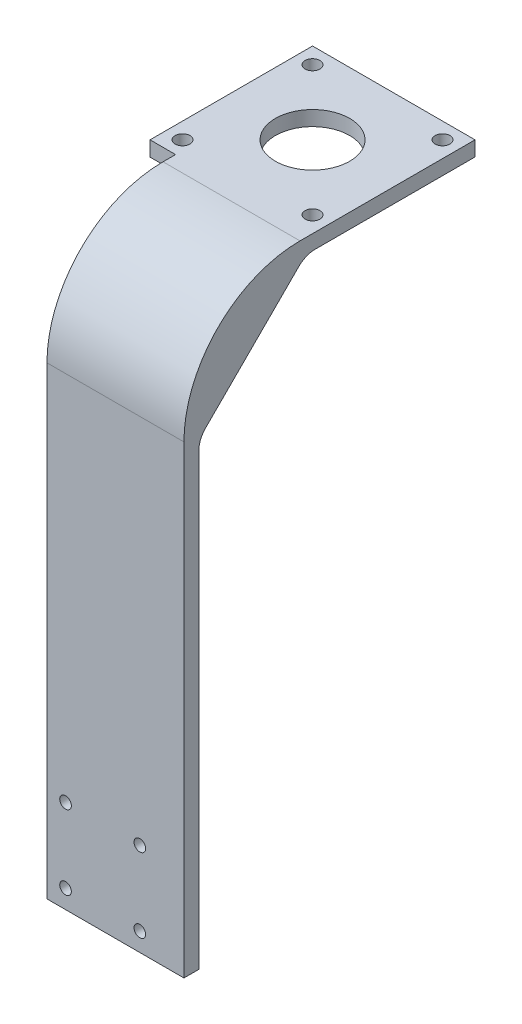
from build123d import *

# Parameters (mm, degrees)
SKETCH1_W           = 24
SKETCH1_H           = 125
SKETCH1_R           = 1.25
BOSS_EXTRUDE1_DEPTH = 3.2
SKETCH2_W           = 24
SKETCH2_H           = 3.2
BOSS_EXTRUDE2_DEPTH = 42
SKETCH3_W           = 35
SKETCH3_H           = 35
SKETCH3_R           = 1.6
BOSS_EXTRUDE3_DEPTH = 3.2
SKETCH4_R           = 8
CUT_EXTRUDE1_DEPTH  = 3.2
CHAMFER1_SIZE       = 23
FILLET1_R           = 25
FILLET2_R           = 5
BOSS_EXTRUDE4_START = 5.5
BOSS_EXTRUDE4_DEPTH = 5.5


with BuildPart() as part:
    # Sketch1 → Boss-Extrude1 (new body)
    with BuildSketch(Plane.XY):
        with Locations((0, 50.5)):
            Rectangle(SKETCH1_W, SKETCH1_H)
        with Locations((-8, 8)):
            Circle(SKETCH1_R, mode=Mode.SUBTRACT)
        with Locations((8, 8)):
            Circle(SKETCH1_R, mode=Mode.SUBTRACT)
        with Locations((8, -8)):
            Circle(SKETCH1_R, mode=Mode.SUBTRACT)
        with Locations((-8, -8)):
            Circle(SKETCH1_R, mode=Mode.SUBTRACT)
    extrude(amount=BOSS_EXTRUDE1_DEPTH)

    # Sketch2 → Boss-Extrude2 (add)
    with BuildSketch(Plane(origin=(0, 0, 0), x_dir=(-1, 0, 0), z_dir=(0, 0, -1))):
        with Locations((0, 111.4)):
            Rectangle(SKETCH2_W, SKETCH2_H)
    extrude(amount=BOSS_EXTRUDE2_DEPTH)

    # Sketch3 → Boss-Extrude3 (add)
    with BuildSketch(Plane(origin=(0, 113, 0), x_dir=(1, 0, 0), z_dir=(0, 1, 0))):
        with Locations((0, 42)):
            Rectangle(SKETCH3_W, SKETCH3_H)
        with Locations(Location((14, 28, 0), (0, 0, 270))):
            Circle(SKETCH3_R, mode=Mode.SUBTRACT)
        with Locations(Location((14, 56, 0), (0, 0, 270))):
            Circle(SKETCH3_R, mode=Mode.SUBTRACT)
        with Locations(Location((-14, 56, 0), (0, 0, 270))):
            Circle(SKETCH3_R, mode=Mode.SUBTRACT)
        with Locations(Location((-14, 28, 0), (0, 0, 270))):
            Circle(SKETCH3_R, mode=Mode.SUBTRACT)
    extrude(amount=-BOSS_EXTRUDE3_DEPTH)

    # Sketch4 → Cut-Extrude1 (cut)
    with BuildSketch(Plane.XZ.offset(-109.8)):
        with Locations(Location((0, -42, 0), (0, 0, 270))):
            Circle(SKETCH4_R)
    extrude(amount=-CUT_EXTRUDE1_DEPTH, mode=Mode.SUBTRACT)

    # Chamfer1
    chamfer1_edges = [part.edges().sort_by_distance(p)[0] for p in [
        (0, 109.8, 0),
    ]]
    chamfer(chamfer1_edges, length=CHAMFER1_SIZE)

    # Fillet1
    fillet1_edges = [part.edges().sort_by_distance(p)[0] for p in [
        (0, 113, 3.2),
    ]]
    fillet(fillet1_edges, radius=FILLET1_R)

    # Fillet2
    fillet2_edges = [part.edges().sort_by_distance(p)[0] for p in [
        (0, 109.8, -23),
        (0, 86.8, 0),
    ]]
    fillet(fillet2_edges, radius=FILLET2_R)

    # Sketch7 → Boss-Extrude4 (add)
    with BuildSketch(Plane(origin=(12, 0, 0), x_dir=(0, 0, -1), z_dir=(1, 0, 0)).offset(BOSS_EXTRUDE4_START)):
        with BuildLine():
            Line((24.5, 113), (21.8, 113))
            ThreePointArc((21.8, 113), (4.12233047, 105.67766953), (-3.2, 88))
            Line((-3.2, 88), (-3.2, -12))
            Line((-3.2, -12), (0, -12))
            Line((0, -12), (0, 84.728932188))
            ThreePointArc((0, 84.728932188), (0.380602337, 86.64234935), (1.464466094, 88.264466094))
            Line((1.464466094, 88.264466094), (21.535533906, 108.335533906))
            ThreePointArc((21.535533906, 108.335533906), (22.896551906, 109.302386098), (24.5, 109.767281103))
            Line((24.5, 109.767281103), (24.5, 113))
        make_face()
    extrude(amount=-BOSS_EXTRUDE4_DEPTH)


solid = part.part
